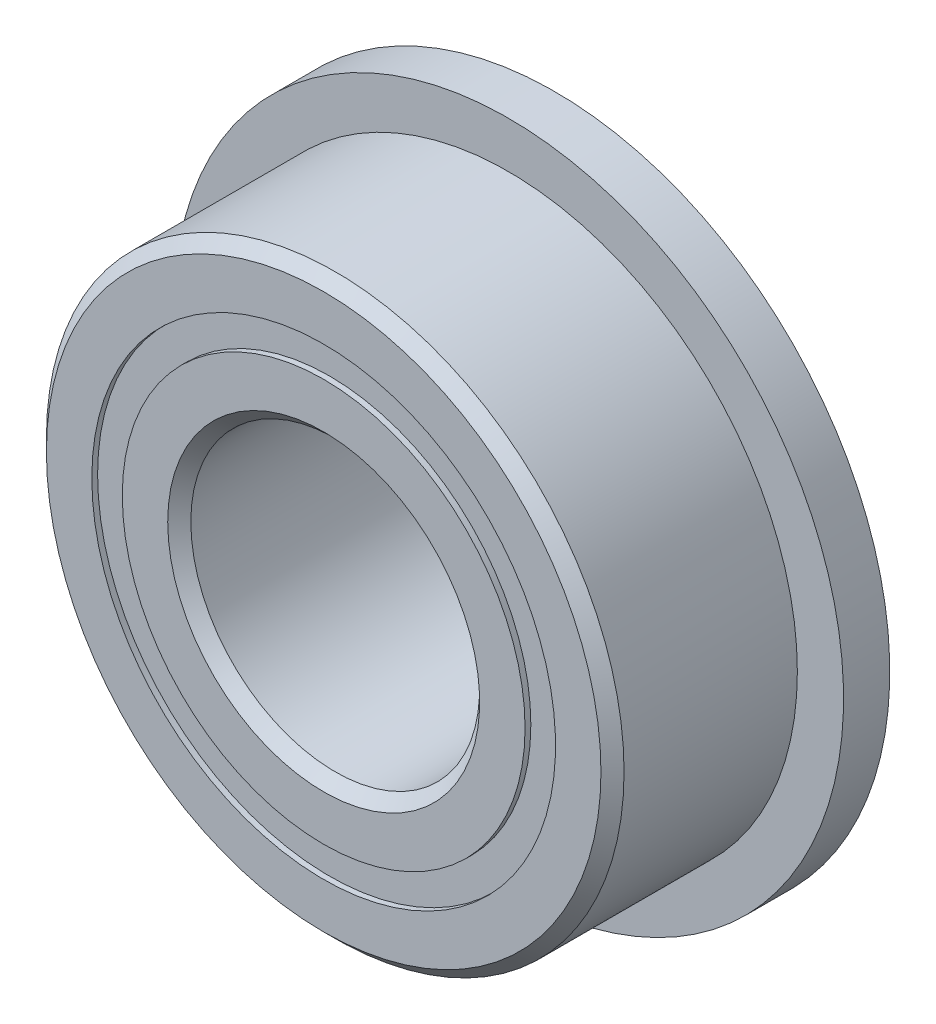
from build123d import *


with BuildPart() as part:
    # Sketch1 → Revolve1 (revolve)
    with BuildSketch(Plane(origin=(0, 0, 0), x_dir=(0, 0, -1), z_dir=(1, 0, 0)), mode=Mode.PRIVATE) as revolve1_sk:
        Polygon((2, 5.8), (1.2, 5.8), (1.2, 5), (-1.8, 5), (-2, 4.8), (-2, 4.013736264), (-1.9, 4.013736264), (-1.9, 3.486263736), (-2, 3.486263736), (-2, 2.7), (-1.8, 2.5), (1.8, 2.5), (2, 2.7), (2, 3.486263736), (1.9, 3.486263736), (1.9, 4.013736264), (2, 4.013736264), align=None)
        with BuildLine():
            Line((-0.888888889, 4.013736264), (-0.927189449, 4.013736264))
            Line((-0.927189449, 4.013736264), (-0.927189449, 3.486263736))
            Line((-0.927189449, 3.486263736), (-0.888888889, 3.486263736))
            ThreePointArc((-0.888888889, 3.486263736), (0, 2.822810552), (0.888888889, 3.486263736))
            Line((0.888888889, 3.486263736), (0.927189449, 3.486263736))
            Line((0.927189449, 3.486263736), (0.927189449, 4.013736264))
            Line((0.927189449, 4.013736264), (0.888888889, 4.013736264))
            ThreePointArc((0.888888889, 4.013736264), (0, 4.677189449), (-0.888888889, 4.013736264))
        make_face(mode=Mode.SUBTRACT)
    revolve(revolve1_sk.sketch.rotate(Axis((0, 0, 0), (0, 0, 1)), 90), axis=Axis((0, 0, 0), (0, 0, 1)))


solid = part.part
